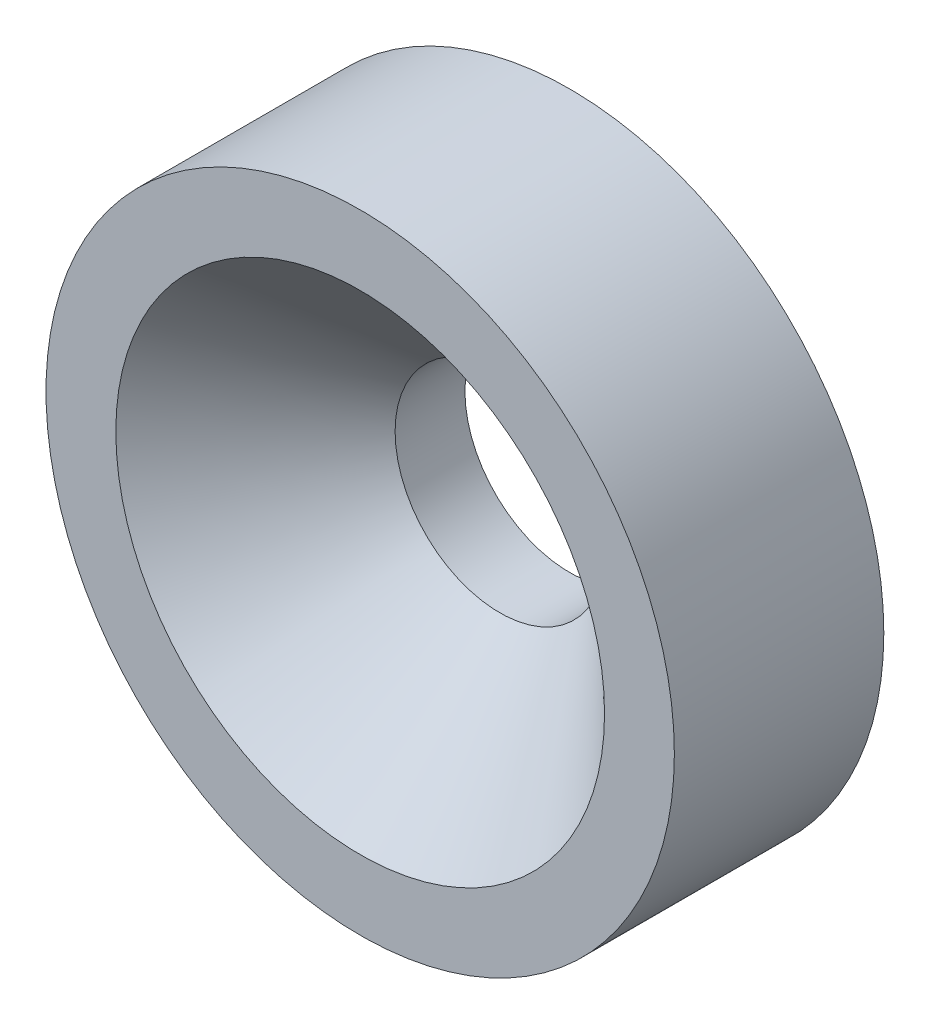
from build123d import *

# Parameters (mm, degrees)
SKETCH_1_R      = 4.5
SKETCH_1_R_2    = 1.5
EXTRUDE_1_DEPTH = 3
CHAMFER_1_SIZE  = 2


with BuildPart() as part:
    # 草图1 → 凸台-拉伸1 (new body)
    with BuildSketch(Plane.XY):
        Circle(SKETCH_1_R)
        Circle(SKETCH_1_R_2, mode=Mode.SUBTRACT)
    extrude(amount=EXTRUDE_1_DEPTH)

    # 倒角1
    chamfer_1_edges = [part.edges().sort_by_distance(p)[0] for p in [
        (-1.5, 0, 3),
    ]]
    chamfer(chamfer_1_edges, length=CHAMFER_1_SIZE)


solid = part.part
